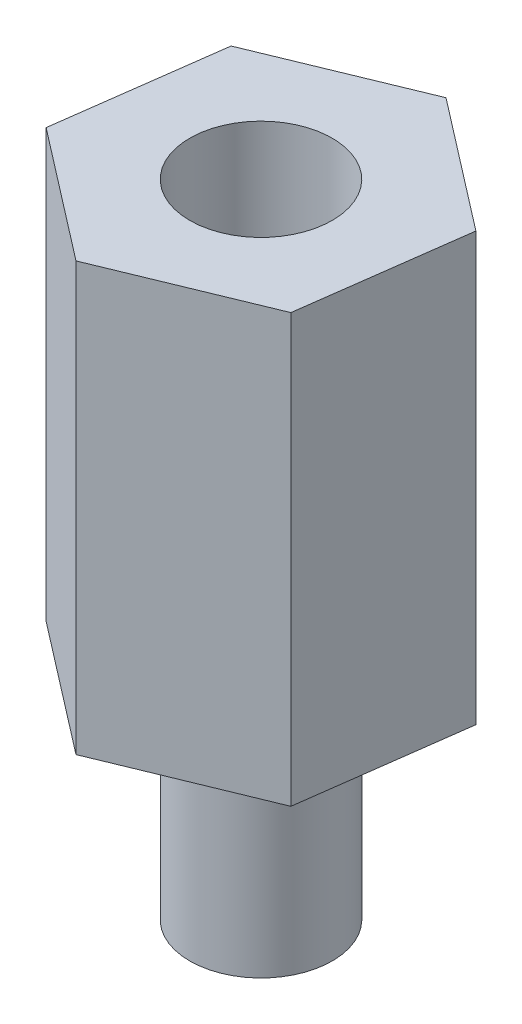
from build123d import *

# Parameters (mm, degrees)
SKETCH1_R           = 1
BOSS_EXTRUDE1_DEPTH = 3
BOSS_EXTRUDE2_DEPTH = 6
CUT_EXTRUDE1_START  = -5
SKETCH3_R           = 1
CUT_EXTRUDE1_DEPTH  = 5


with BuildPart() as part:
    # Sketch1 → Boss-Extrude1 (new body)
    with BuildSketch(Plane(origin=(0, 0, 0), x_dir=(1, 0, 0), z_dir=(0, 1, 0))):
        with Locations(Location((0, 0, 0), (0, 0, 270))):
            Circle(SKETCH1_R)
    extrude(amount=BOSS_EXTRUDE1_DEPTH)

    # Sketch2 → Boss-Extrude2 (add)
    with BuildSketch(Plane(origin=(0, 3, 0), x_dir=(1, 0, 0), z_dir=(0, 1, 0))):
        Polygon((-0.306435831, -2.289584478), (1.829620407, -1.410173453), (2.136056237, 0.879411025), (0.306435831, 2.289584478), (-1.829620407, 1.410173453), (-2.136056237, -0.879411025), align=None)
    extrude(amount=BOSS_EXTRUDE2_DEPTH)

    # Sketch3 → Cut-Extrude1 (cut)
    with BuildSketch(Plane(origin=(0, 9, 0), x_dir=(1, 0, 0), z_dir=(0, 1, 0)).offset(CUT_EXTRUDE1_START)):
        with Locations(Location((0, 0, 0), (0, 0, 270))):
            Circle(SKETCH3_R)
    extrude(amount=CUT_EXTRUDE1_DEPTH, mode=Mode.SUBTRACT)


solid = part.part
